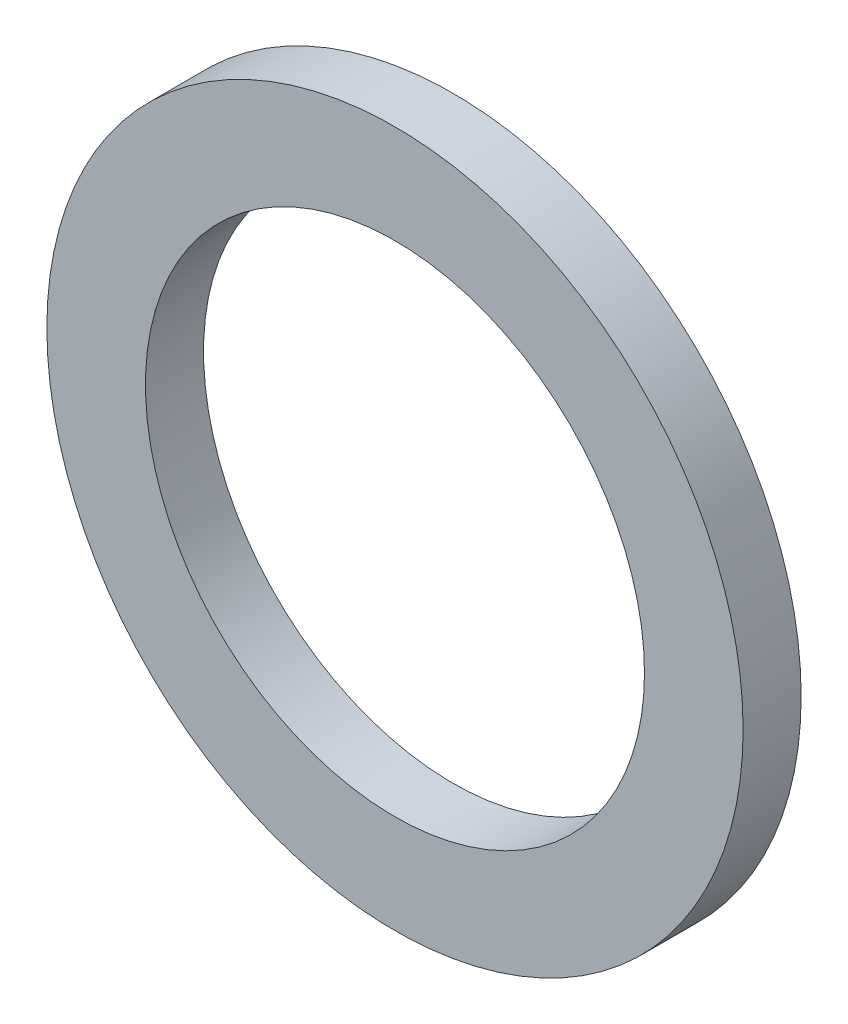
from build123d import *

# Parameters (mm, degrees)
SKETCH_1_R      = 3
SKETCH_1_R_2    = 2.15
EXTRUDE_1_DEPTH = 0.5


with BuildPart() as part:
    # 草图1 → 拉伸1 (new body)
    with BuildSketch(Plane.XY):
        Circle(SKETCH_1_R)
        Circle(SKETCH_1_R_2, mode=Mode.SUBTRACT)
    extrude(amount=EXTRUDE_1_DEPTH)


solid = part.part
